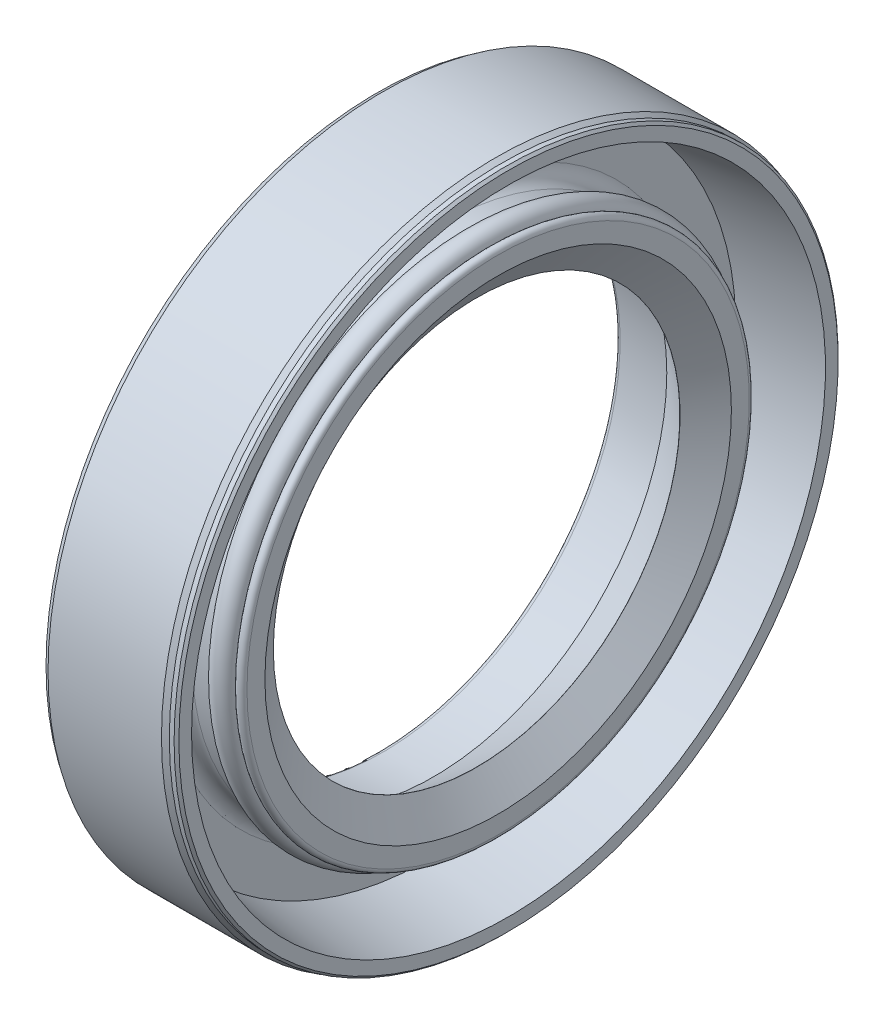
from build123d import *


with BuildPart() as part:
    # Sketch1 → Revolve2 (revolve)
    with BuildSketch(Plane.XY, mode=Mode.PRIVATE) as revolve2_sk:
        with BuildLine():
            Line((0.9025, 10.5), (0.9025, 9.75))
            Line((0.9025, 9.75), (0.005, 8.5))
            Line((0.005, 8.5), (0, 8.5))
            Line((0, 8.5), (-1.7975, 9.75))
            Line((-1.7975, 9.75), (-3.935955602, 9.937090623))
            ThreePointArc((-3.935955602, 9.937090623), (-4.098486001, 10.017241745), (-4.164166667, 10.186139297))
            Line((-4.164166667, 10.186139297), (-4.164166667, 13.833333333))
            Line((-4.164166667, 13.833333333), (-3.914166667, 14))
            Line((-3.914166667, 14), (0.827987236, 14))
            Line((0.827987236, 14), (1.035833333, 13.88))
            Line((1.035833333, 13.88), (1.235833333, 13.88))
            Line((1.235833333, 13.88), (1.335833333, 13.78))
            Line((1.335833333, 13.78), (1.335833333, 13.25))
            Line((1.335833333, 13.25), (-1.9975, 12.833333333))
            Line((-1.9975, 12.833333333), (-1.9975, 11.1))
            ThreePointArc((-1.9975, 11.1), (-1.821764069, 10.675735931), (-1.3975, 10.5))
            Line((-1.3975, 10.5), (-0.4975, 10.5))
            ThreePointArc((-0.4975, 10.5), (0.0025, 11), (0.5025, 10.5))
            ThreePointArc((0.5025, 10.5), (0.7025, 10.7), (0.9025, 10.5))
        make_face()
    revolve(revolve2_sk.sketch.rotate(Axis((0, 0, 0), (1, 0, 0)), 90), axis=Axis((0, 0, 0), (1, 0, 0)))


solid = part.part
